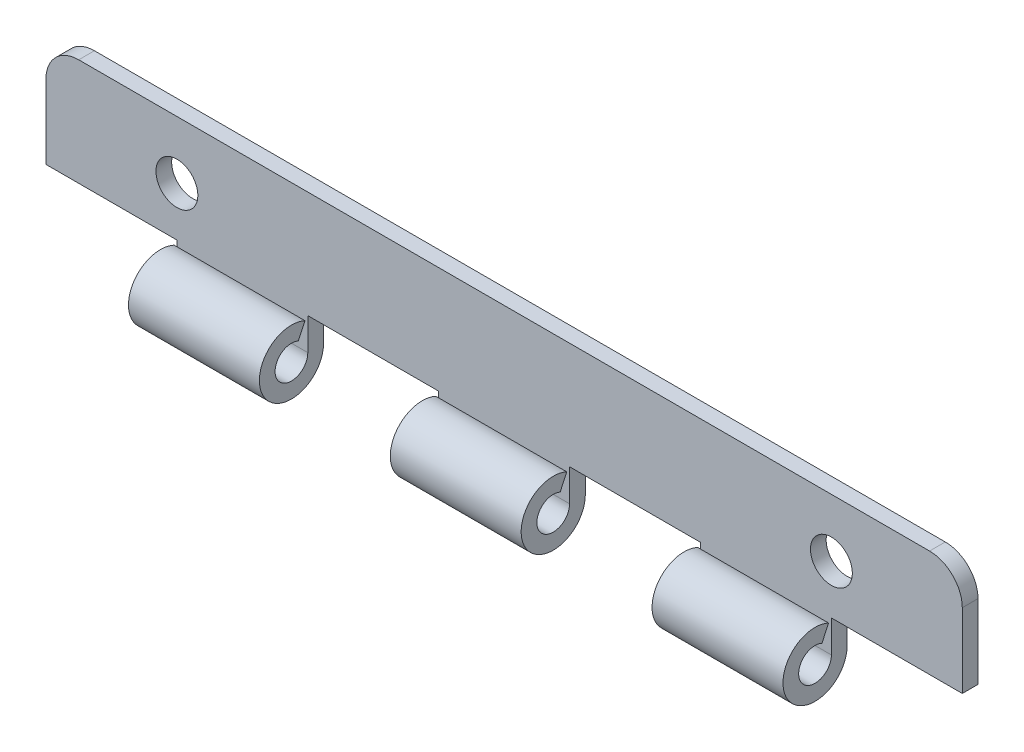
from build123d import *

# Parameters (mm, degrees)
BOSS_EXTRUDE1_DEPTH = 304.8
SKETCH4_W           = 12.7
SKETCH4_H           = 6.223
CUT_EXTRUDE1_DEPTH  = 306.114409233
LPATTERN1_COUNT     = 24
LPATTERN1_PITCH     = 25.4
BOSS_EXTRUDE2_DEPTH = 609.6
SKETCH6_W           = 12.7
SKETCH6_H           = 6.223
CUT_EXTRUDE2_DEPTH  = 306.114409233
LPATTERN2_COUNT     = 24
LPATTERN2_PITCH     = 25.4
SKETCH7_R           = 1.5875
BOSS_EXTRUDE3_DEPTH = 609.6
CHAMFER1_SIZE       = 0.3175
CUT_EXTRUDE3_START  = -88.9
SKETCH8_W           = 11.762471384
SKETCH8_H           = 30.066276354
CUT_EXTRUDE3_DEPTH  = 521.857265411
FILLET1_R           = 3.175
SKETCH9_R           = 2.032
SKETCH9_R_2         = 2.031999998
CUT_EXTRUDE4_DEPTH  = 306.162001268


with BuildPart() as part:
    # Sketch3 → Boss-Extrude1 (new, symmetric)
    with BuildSketch(Plane(origin=(0, 0, 0), x_dir=(0, 0, -1), z_dir=(1, 0, 0))):
        with BuildLine():
            Line((1.5875, 0), (1.5875, -2.676056053))
            Line((1.5875, -2.676056053), (1.5875, -13.49375))
            Line((1.5875, -13.49375), (3.1115, -13.49375))
            Line((3.1115, -13.49375), (3.1115, 0))
            ThreePointArc((3.1115, 0), (-2.624212484, 1.671807731), (1.314976721, -2.819976679))
            Line((1.314976721, -2.819976679), (0.670906491, -1.438763612))
            ThreePointArc((0.670906491, -1.438763612), (-1.33888392, 0.852963128), (1.5875, 0))
        make_face()
    extrude(amount=BOSS_EXTRUDE1_DEPTH, both=True)

    # Sketch4 → Cut-Extrude1 (cut, symmetric)
    with BuildSketch(Plane.XY):
        with Locations((298.45, 0)):
            Rectangle(SKETCH4_W, SKETCH4_H)
    cut_extrude1 = extrude(amount=CUT_EXTRUDE1_DEPTH, both=True, mode=Mode.SUBTRACT)

    # LPattern1: Cut-Extrude1 ×24
    with Locations(*[(-i * LPATTERN1_PITCH, 0, 0) for i in range(1, LPATTERN1_COUNT)]):
        add(cut_extrude1, mode=Mode.SUBTRACT)


with BuildPart() as body_2:
    # Sketch5 → Boss-Extrude2 (new body)
    with BuildSketch(Plane(origin=(304.8, 0, 0), x_dir=(0, 0, -1), z_dir=(1, 0, 0))):
        with BuildLine():
            Line((1.5875, 13.49375), (1.5875, 2.676056053))
            Line((1.5875, 2.676056053), (1.5875, 0))
            ThreePointArc((1.5875, 0), (-1.33888392, -0.852963128), (0.670906491, 1.438763612))
            Line((0.670906491, 1.438763612), (1.314976721, 2.819976679))
            ThreePointArc((1.314976721, 2.819976679), (-2.624212484, -1.671807731), (3.1115, 0))
            Line((3.1115, 0), (3.1115, 13.49375))
            Line((3.1115, 13.49375), (1.5875, 13.49375))
        make_face()
    extrude(amount=-BOSS_EXTRUDE2_DEPTH)

    # Sketch6 → Cut-Extrude2 (cut, symmetric)
    with BuildSketch(Plane.XY):
        with Locations((285.75, 0)):
            Rectangle(SKETCH6_W, SKETCH6_H)
    cut_extrude2 = extrude(amount=CUT_EXTRUDE2_DEPTH, both=True, mode=Mode.SUBTRACT)

    # LPattern2: Cut-Extrude2 ×24
    with Locations(*[(-i * LPATTERN2_PITCH, 0, 0) for i in range(1, LPATTERN2_COUNT)]):
        add(cut_extrude2, mode=Mode.SUBTRACT)


with BuildPart() as body_3:
    # Sketch7 → Boss-Extrude3 (new body)
    with BuildSketch(Plane(origin=(304.8, 0, 0), x_dir=(0, 0, -1), z_dir=(1, 0, 0))):
        Circle(SKETCH7_R)
    extrude(amount=-BOSS_EXTRUDE3_DEPTH)

    # Chamfer1
    chamfer1_edges = [body_3.edges().sort_by_distance(p)[0] for p in [
        (304.8, 0, 1.5875),
        (-304.8, 0, 1.5875),
    ]]
    chamfer(chamfer1_edges, length=CHAMFER1_SIZE)


with BuildPart() as cut_extrude3_tool:
    # Sketch8 → Cut-Extrude3 (new, through all)
    with BuildSketch(Plane.ZY.offset(304.8).offset(CUT_EXTRUDE3_START)):
        Rectangle(SKETCH8_W, SKETCH8_H)
    extrude(amount=-CUT_EXTRUDE3_DEPTH)


with BuildPart() as part_1:
    add(part.part)

    # Cut-Extrude3: cut by cut_extrude3_tool
    add(cut_extrude3_tool.part, mode=Mode.SUBTRACT)


with BuildPart() as body_2_1:
    add(body_2.part)

    # Cut-Extrude3: cut by cut_extrude3_tool
    add(cut_extrude3_tool.part, mode=Mode.SUBTRACT)

    # Fillet1
    fillet1_edges = [body_2_1.edges().sort_by_distance(p)[0] for p in [
        (-304.8, 13.49375, -2.3495),
        (-215.9, 13.49375, -2.3495),
    ]]
    fillet(fillet1_edges, radius=FILLET1_R)

    # Sketch9 → Cut-Extrude4 (cut, through all)
    with BuildSketch(Plane(origin=(0, 0, -3.1115), x_dir=(-1, 0, 0), z_dir=(0, 0, -1))):
        with Locations(Location((228.600000002, 7.874000002, 0), (0, 0, 90))):
            Circle(SKETCH9_R)
        with Locations(Location((292.100000002, 7.874000002, 0), (0, 0, 90))):
            Circle(SKETCH9_R_2)
    extrude(amount=-CUT_EXTRUDE4_DEPTH, mode=Mode.SUBTRACT)


with BuildPart() as body_3_1:
    add(body_3.part)

    # Cut-Extrude3: cut by cut_extrude3_tool
    add(cut_extrude3_tool.part, mode=Mode.SUBTRACT)


solid = body_2_1.part
